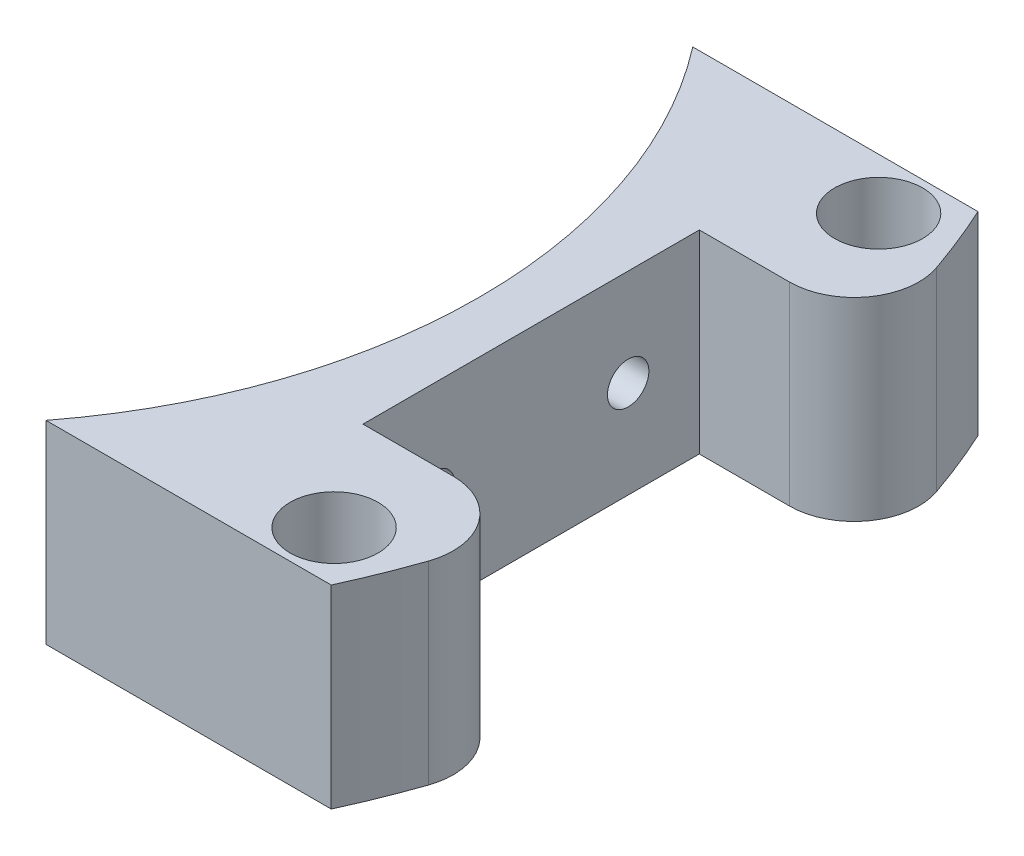
from build123d import *

# Parameters (mm, degrees)
SKETCH_1_R          = 3.4
EXTRUDE_2_DEPTH     = 15
CUT_EXTRUDE_1_DEPTH = 104.680547991
CUT_EXTRUDE_2_DEPTH = 103.721548766
CUT_EXTRUDE_START   = -10
SKETCH_6_R          = 3.5
SKETCH_6_R_2        = 1.6
CUT_EXTRUDE_3_DEPTH = 10
FILLET_1_R          = 5


with BuildPart() as part:
    # 草图1 → 凸台-拉伸2 (new body)
    with BuildSketch(Plane(origin=(0, 0, 0), x_dir=(1, 0, 0), z_dir=(0, 1, 0))):
        with BuildLine():
            ThreePointArc((-7.95357839, 100.709696918), (0.550267992, 75.709696918), (-7.95357839, 50.709696918))
            Line((-7.95357839, 50.709696918), (14.093828565, 50.709696918))
            ThreePointArc((14.093828565, 50.709696918), (19.550267992, 75.709696918), (14.093828565, 100.709696918))
            Line((14.093828565, 100.709696918), (-7.95357839, 100.709696918))
        make_face()
        with Locations(Location((10.36364228, 96.757285698, 0), (0, 0, 270))):
            Circle(SKETCH_1_R, mode=Mode.SUBTRACT)
        with Locations(Location((10.36364228, 54.662108138, 0), (0, 0, 270))):
            Circle(SKETCH_1_R, mode=Mode.SUBTRACT)
    extrude(amount=EXTRUDE_2_DEPTH)

    # 草图2 → 切除-拉伸1 (cut, through all)
    with BuildSketch(Plane(origin=(0, 15, 0), x_dir=(1, 0, 0), z_dir=(0, 1, 0))):
        with BuildLine():
            Line((4.550267992, 88.709696918), (4.550267992, 75.709696918))
            Line((4.550267992, 75.709696918), (19.550267992, 75.709696918))
            ThreePointArc((19.550267992, 75.709696918), (19.192888302, 82.248645039), (18.125006574, 88.709696918))
            Line((18.125006574, 88.709696918), (4.550267992, 88.709696918))
        make_face()
        with BuildLine():
            Line((19.550267992, 75.709696918), (4.550267992, 75.709696918))
            Line((4.550267992, 75.709696918), (4.550267992, 62.709696918))
            Line((4.550267992, 62.709696918), (18.125006574, 62.709696918))
            ThreePointArc((18.125006574, 62.709696918), (19.192888302, 69.170748797), (19.550267992, 75.709696918))
        make_face()
    extrude(amount=-CUT_EXTRUDE_1_DEPTH, mode=Mode.SUBTRACT)

    # 草图4 → 切除-拉伸2 (cut, through all)
    with BuildSketch(Plane(origin=(4.550267992, 0, 0), x_dir=(0, 0, -1), z_dir=(1, 0, 0))):
        with BuildLine():
            ThreePointArc((84.809696918, 7.5), (83.209696918, 9.1), (81.609696918, 7.5))
            Line((81.609696918, 7.5), (84.809696918, 7.5))
        make_face()
        with BuildLine():
            Line((84.809696918, 7.5), (81.609696918, 7.5))
            ThreePointArc((81.609696918, 7.5), (83.209696918, 5.9), (84.809696918, 7.5))
        make_face()
        with BuildLine():
            ThreePointArc((69.809696918, 7.5), (68.209696918, 9.1), (66.609696918, 7.5))
            Line((66.609696918, 7.5), (69.809696918, 7.5))
        make_face()
        with BuildLine():
            Line((69.809696918, 7.5), (66.609696918, 7.5))
            ThreePointArc((66.609696918, 7.5), (68.209696918, 5.9), (69.809696918, 7.5))
        make_face()
    extrude(amount=-CUT_EXTRUDE_2_DEPTH, mode=Mode.SUBTRACT)

    # 草图6 → 切除-拉伸3 (cut)
    # profile 1 of 2: a face of its own
    with BuildSketch(Plane.ZY.offset(7.95357839).offset(CUT_EXTRUDE_START)):
        with Locations((-83.209696918, 7.5)):
            Circle(SKETCH_6_R)
        with Locations(Location((-83.209696918, 7.5, 0), (0, 0, 180))):
            Circle(SKETCH_6_R_2, mode=Mode.SUBTRACT)
    # profile 2 of 2: a face of its own
    with BuildSketch(Plane.ZY.offset(7.95357839).offset(CUT_EXTRUDE_START)):
        with Locations((-68.209696918, 7.5)):
            Circle(SKETCH_6_R)
        with Locations(Location((-68.209696918, 7.5, 0), (0, 0, 180))):
            Circle(SKETCH_6_R_2, mode=Mode.SUBTRACT)
    extrude(amount=CUT_EXTRUDE_3_DEPTH, mode=Mode.SUBTRACT)

    # 圆角1
    fillet_1_edges = [part.edges().sort_by_distance(p)[0] for p in [
        (18.125006574, 7.5, -88.709696918),
        (18.125006574, 7.5, -62.709696918),
    ]]
    fillet(fillet_1_edges, radius=FILLET_1_R)


solid = part.part
